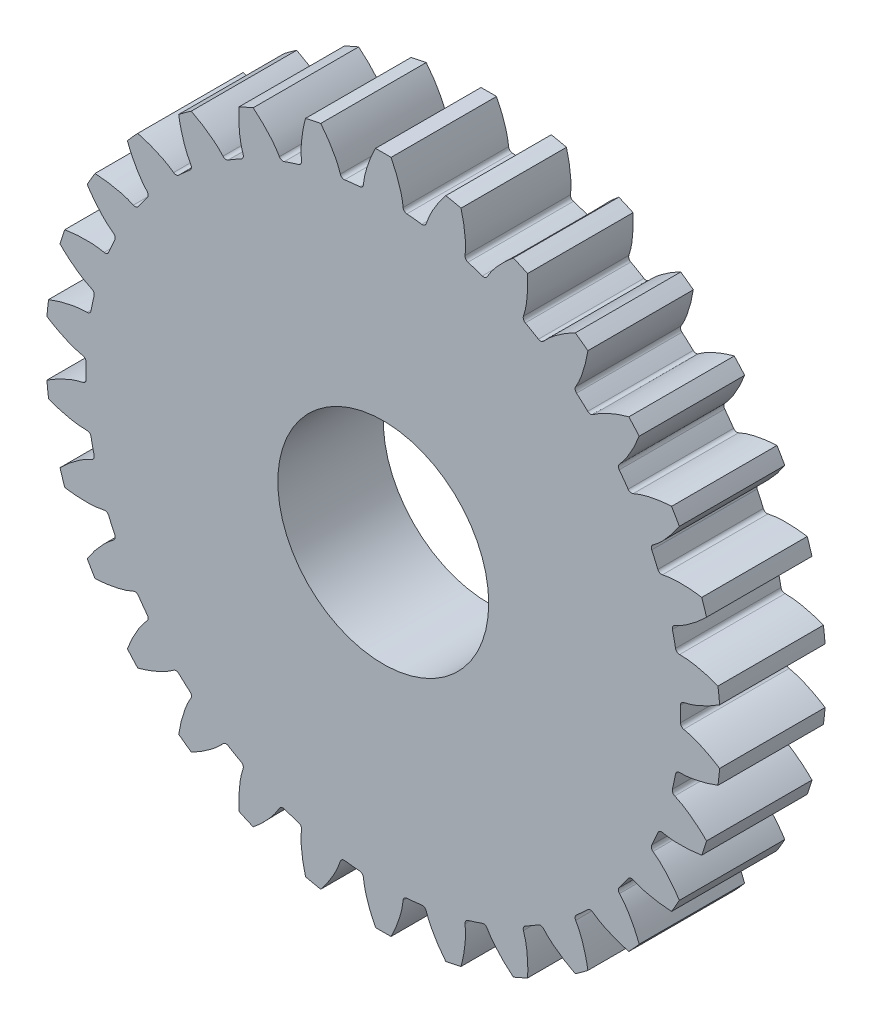
from build123d import *

# Parameters (mm, degrees)
CIRCLES_R                       = 32
GEAR_EXTRUDE_DEPTH              = 10
EXTRUDED_CUT1_DEPTH             = 47.346520905
FILLET1_R                       = 0.38
CIRCULAR_PARTTERN1_COUNT        = 30
FILLET1_OF_CIRCULAR_PARTTERN1_R = 0.38
SKETCH1_R                       = 10
CUT_EXTRUDE1_DEPTH              = 10


with BuildPart() as part:
    # circles → Gear_extrude (new body)
    with BuildSketch(Plane.XY):
        Circle(CIRCLES_R)
    extrude(amount=GEAR_EXTRUDE_DEPTH)

    # Db_Df → extruded-cut1 (cut, through all)
    with BuildSketch(Plane.XY.offset(10)):
        with BuildLine():
            Line((43.195260585, 29.829221635), (60.24780414, -1.577593327))
            Line((60.24780414, -1.577593327), (43.195260585, -29.829221635))
            add(Edge.make_bspline(
                [(28.171006316, -1.055652659), (28.222330565, -1.059287511), (28.36576505, -1.074751718), (28.63444311, -1.124727659), (29.066544171, -1.235348153), (29.605856963, -1.418340301), (30.286220251, -1.702131211), (31.062919909, -2.095569073), (31.886221202, -2.588218453), (32.96015221, -3.33592167), (34.172835825, -4.336988753), (35.451034565, -5.599810453), (36.776880432, -7.173914188), (37.968062752, -8.851748884), (39.028539988, -10.61489508), (39.97640045, -12.483857451), (40.795821505, -14.412381573), (41.403764256, -16.141971527), (41.849276483, -17.648429077), (42.171275731, -18.917053167), (42.399761691, -19.938927686), (42.649530672, -21.223675861), (42.852230114, -22.517031266), (43.008946515, -23.816501894), (43.120707656, -25.120748309), (43.183586344, -26.165545804), (43.215694433, -27.081865638), (43.227206025, -27.865688083), (43.226041731, -28.52321693), (43.219399456, -29.033262178), (43.20775375, -29.468288559), (43.199715671, -29.710333787), (43.195260585, -29.829221635)],
                knots=[0, 0, 0, 0, 0, 0.005376747, 0.015083687, 0.028531819, 0.046610138, 0.064854847, 0.092110523, 0.119476173, 0.146842493, 0.201574954, 0.256307345, 0.307035031, 0.361767349, 0.416499658, 0.471231934, 0.525964279, 0.580696613, 0.608062797, 0.635428981, 0.662795184, 0.690161387, 0.744893689, 0.772259886, 0.799626084, 0.826992247, 0.854358411, 0.868041538, 0.881724665, 0.895407792, 0.909090919, 0.909090919, 0.909090919, 0.909090919, 0.909090919], degree=4))
            ThreePointArc((28.171006316, -1.055652659), (28.190778624, 0), (28.171006316, 1.055652659))
            add(Edge.make_bspline(
                [(28.171006316, 1.055652659), (28.222330565, 1.059287511), (28.36576505, 1.074751718), (28.63444311, 1.124727659), (29.066544171, 1.235348153), (29.605856963, 1.418340301), (30.286220251, 1.702131211), (31.062919909, 2.095569073), (31.886221202, 2.588218453), (32.96015221, 3.33592167), (34.172835825, 4.336988753), (35.451034565, 5.599810453), (36.776880432, 7.173914188), (37.968062752, 8.851748884), (39.028539988, 10.61489508), (39.97640045, 12.483857451), (40.795821505, 14.412381573), (41.403764256, 16.141971527), (41.849276483, 17.648429077), (42.171275731, 18.917053167), (42.399761691, 19.938927686), (42.649530672, 21.223675861), (42.852230114, 22.517031266), (43.008946515, 23.816501894), (43.120707656, 25.120748309), (43.183586344, 26.165545804), (43.215694433, 27.081865638), (43.227206025, 27.865688083), (43.226041731, 28.52321693), (43.219399456, 29.033262178), (43.20775375, 29.468288559), (43.199715671, 29.710333787), (43.195260585, 29.829221635)],
                knots=[0, 0, 0, 0, 0, 0.005376747, 0.015083687, 0.028531819, 0.046610138, 0.064854847, 0.092110523, 0.119476173, 0.146842493, 0.201574954, 0.256307345, 0.307035031, 0.361767349, 0.416499658, 0.471231934, 0.525964279, 0.580696613, 0.608062797, 0.635428981, 0.662795184, 0.690161387, 0.744893689, 0.772259886, 0.799626084, 0.826992247, 0.854358411, 0.868041538, 0.881724665, 0.895407792, 0.909090919, 0.909090919, 0.909090919, 0.909090919, 0.909090919], degree=4))
        make_face()
    extruded_cut1 = extrude(amount=-EXTRUDED_CUT1_DEPTH, mode=Mode.SUBTRACT)

    # fillet1
    fillet1_edges = [part.edges().sort_by_distance(p)[0] for p in [
        (28.171006316, -1.055652659, 5),
        (28.171006316, 1.055652659, 5),
    ]]
    fillet(fillet1_edges, radius=FILLET1_R)

    # circular-parttern1: extruded-cut1 ×30 about axis
    circular_parttern1_axis = Axis((0, 0, 10), (0, 0, -1))
    for i in range(1, CIRCULAR_PARTTERN1_COUNT):
        add(extruded_cut1.rotate(circular_parttern1_axis, i * 360 / CIRCULAR_PARTTERN1_COUNT), mode=Mode.SUBTRACT)

    # fillet1 of circular-parttern1
    fillet1_of_circular_parttern1_edges = [part.edges().sort_by_distance(p)[0] for p in [
        (27.335919709, -6.889665671, 5),
        (27.774884768, -4.82449744, 5),
        (25.306122239, -12.422567232, 5),
        (26.164867476, -10.49379385, 5),
        (22.170325794, -17.412542996, 5),
        (23.411319923, -15.704461114, 5),
        (18.065579727, -21.641507076, 5),
        (19.634585349, -20.228768069, 5),
        (13.171281138, -24.924633449, 5),
        (14.999725178, -23.868980791, 5),
        (7.70133436, -27.118433739, 5),
        (9.709305041, -26.466004516, 5),
        (1.894802316, -28.127028346, 5),
        (3.994541682, -27.906336846, 5),
        (-3.994541682, -27.906336846, 5),
        (-1.894802316, -28.127028346, 5),
        (-9.709305041, -26.466004516, 5),
        (-7.70133436, -27.118433739, 5),
        (-14.999725178, -23.868980791, 5),
        (-13.171281138, -24.924633449, 5),
        (-19.634585349, -20.228768069, 5),
        (-18.065579727, -21.641507076, 5),
        (-23.411319923, -15.704461114, 5),
        (-22.170325794, -17.412542996, 5),
        (-26.164867476, -10.49379385, 5),
        (-25.306122239, -12.422567232, 5),
        (-27.774884768, -4.82449744, 5),
        (-27.335919709, -6.889665671, 5),
        (-28.171006316, 1.055652659, 5),
        (-28.171006316, -1.055652659, 5),
        (-27.335919709, 6.889665671, 5),
        (-27.774884768, 4.82449744, 5),
        (-25.306122239, 12.422567232, 5),
        (-26.164867476, 10.49379385, 5),
        (-22.170325794, 17.412542996, 5),
        (-23.411319923, 15.704461114, 5),
        (-18.065579727, 21.641507076, 5),
        (-19.634585349, 20.228768069, 5),
        (-13.171281138, 24.924633449, 5),
        (-14.999725178, 23.868980791, 5),
        (-7.70133436, 27.118433739, 5),
        (-9.709305041, 26.466004516, 5),
        (-1.894802316, 28.127028346, 5),
        (-3.994541682, 27.906336846, 5),
        (3.994541682, 27.906336846, 5),
        (1.894802316, 28.127028346, 5),
        (9.709305041, 26.466004516, 5),
        (7.70133436, 27.118433739, 5),
        (14.999725178, 23.868980791, 5),
        (13.171281138, 24.924633449, 5),
        (19.634585349, 20.228768069, 5),
        (18.065579727, 21.641507076, 5),
        (23.411319923, 15.704461114, 5),
        (22.170325794, 17.412542996, 5),
        (26.164867476, 10.49379385, 5),
        (25.306122239, 12.422567232, 5),
        (27.774884768, 4.82449744, 5),
        (27.335919709, 6.889665671, 5),
    ]]
    fillet(fillet1_of_circular_parttern1_edges, radius=FILLET1_OF_CIRCULAR_PARTTERN1_R)

    # Sketch1 → Cut-Extrude1 (cut)
    with BuildSketch(Plane.XY):
        Circle(SKETCH1_R)
    extrude(amount=CUT_EXTRUDE1_DEPTH, mode=Mode.SUBTRACT)


solid = part.part
